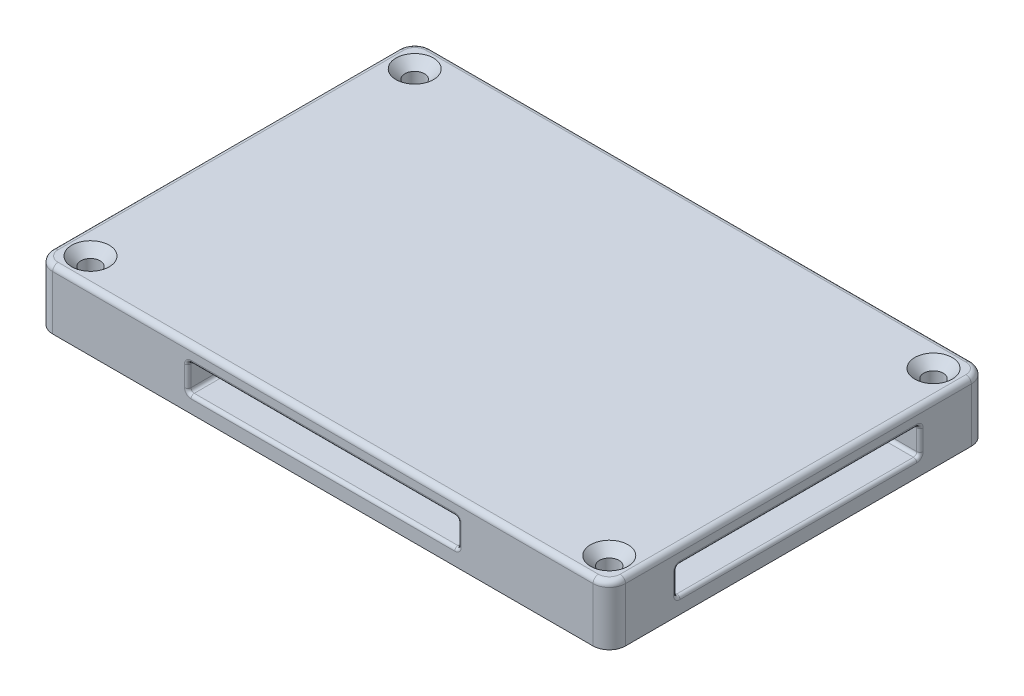
from build123d import *

# Parameters (mm, degrees)
CROQUIS1_W                                           = 106
CROQUIS1_H                                           = 70
SALIENTE_EXTRUIR1_DEPTH                              = 11
CROQUIS2_W                                           = 50
CROQUIS2_H                                           = 5
CORTAR_EXTRUIR1_DEPTH                                = 128.502941143
CROQUIS3_W                                           = 45
CROQUIS3_H                                           = 5
CORTAR_EXTRUIR2_DEPTH                                = 128.502941143
REDONDEO1_R                                          = 3
AVELLANADO_PARA_TORNILLO_CON_CABEZA_AVEL_D           = 3.6
AVELLANADO_PARA_TORNILLO_CON_CABEZA_AVEL_CSINK_D     = 6.94
AVELLANADO_PARA_TORNILLO_CON_CABEZA_AVEL_CSINK_ANGLE = 90
REDONDEO2_R                                          = 1
REDONDEO3_R                                          = 0.6


with BuildPart() as part:
    # Croquis1 → Saliente-Extruir1 (new body)
    with BuildSketch(Plane(origin=(0, 0, 0), x_dir=(1, 0, 0), z_dir=(0, 1, 0))):
        with Locations((53, 35)):
            Rectangle(CROQUIS1_W, CROQUIS1_H)
    extrude(amount=SALIENTE_EXTRUIR1_DEPTH)

    # Croquis2 → Cortar-Extruir1 (cut, through all)
    with BuildSketch(Plane.XY):
        with Locations((53, 5.5)):
            Rectangle(CROQUIS2_W, CROQUIS2_H)
    extrude(amount=-CORTAR_EXTRUIR1_DEPTH, mode=Mode.SUBTRACT)

    # Croquis3 → Cortar-Extruir2 (cut, through all)
    with BuildSketch(Plane(origin=(106, 0, 0), x_dir=(0, 0, -1), z_dir=(1, 0, 0))):
        with Locations((35, 5.5)):
            Rectangle(CROQUIS3_W, CROQUIS3_H)
    extrude(amount=-CORTAR_EXTRUIR2_DEPTH, mode=Mode.SUBTRACT)

    # Redondeo1
    redondeo1_edges = [part.edges().sort_by_distance(p)[0] for p in [
        (0, 5.5, -70),
        (106, 5.5, -70),
        (106, 5.5, 0),
        (0, 5.5, 0),
    ]]
    fillet(redondeo1_edges, radius=REDONDEO1_R)

    # Avellanado para tornillo con cabeza avellanada de clavija hexagonal de M32 (through all)
    with Locations(Plane(origin=(0, 11, 0), x_dir=(1, 0, 0), z_dir=(0, 1, 0))):
        with Locations((5, 65), (101, 65), (101, 5), (5, 5)):
            CounterSinkHole(AVELLANADO_PARA_TORNILLO_CON_CABEZA_AVEL_D / 2, AVELLANADO_PARA_TORNILLO_CON_CABEZA_AVEL_CSINK_D / 2, counter_sink_angle=AVELLANADO_PARA_TORNILLO_CON_CABEZA_AVEL_CSINK_ANGLE)

    # Redondeo2
    redondeo2_edges = [part.edges().sort_by_distance(p)[0] for p in [
        (53, 11, 0),
        (0, 11, -35),
        (106, 11, -35),
        (53, 11, -70),
        (105.121320344, 11, -0.878679656),
        (105.121320344, 11, -69.121320344),
        (0.878679656, 11, -69.121320344),
        (0.878679656, 11, -0.878679656),
    ]]
    fillet(redondeo2_edges, radius=REDONDEO2_R)

    # Redondeo3
    redondeo3_edges = [part.edges().sort_by_distance(p)[0] for p in [
        (78, 5.5, -70),
        (78, 8, -63.75),
        (53, 3, -70),
        (78, 3, -63.75),
        (28, 5.5, -70),
        (28, 3, -63.75),
        (53, 8, -70),
        (28, 8, -63.75),
        (78, 5.5, 0),
        (53, 8, 0),
        (28, 5.5, 0),
        (53, 3, 0),
        (28, 8, -6.25),
        (78, 8, -6.25),
        (28, 3, -6.25),
        (78, 3, -6.25),
        (92, 3, -57.5),
        (14, 3, -57.5),
        (0, 3, -35),
        (92, 8, -12.5),
        (14, 8, -12.5),
        (0, 8, -35),
        (78, 5.5, -57.5),
        (92, 8, -57.5),
        (14, 8, -57.5),
        (28, 5.5, -57.5),
        (0, 5.5, -57.5),
        (78, 5.5, -12.5),
        (92, 3, -12.5),
        (14, 3, -12.5),
        (28, 5.5, -12.5),
        (0, 5.5, -12.5),
        (106, 5.5, -57.5),
        (106, 8, -35),
        (106, 5.5, -12.5),
        (106, 3, -35),
    ]]
    fillet(redondeo3_edges, radius=REDONDEO3_R)


solid = part.part
